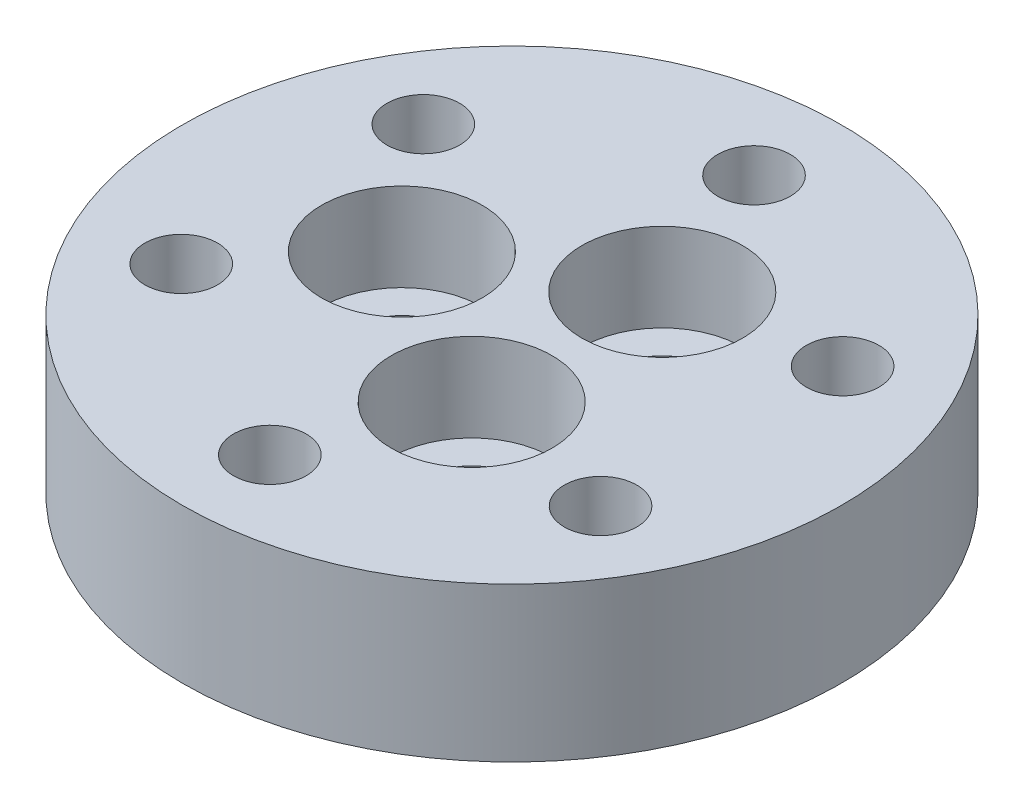
from build123d import *

# Parameters (mm, degrees)
SKETCH_1_R          = 14.975
EXTRUDE_1_DEPTH     = 7
SKETCH_2_R          = 2.1
CUT_EXTRUDE_1_DEPTH = 10
SKETCH_3_R          = 1.65
CUT_EXTRUDE_2_DEPTH = 10
SKETCH_5_R          = 3.65
CUT_EXTRUDE_3_DEPTH = 4


with BuildPart() as part:
    # 草图1 → 凸台-拉伸1 (new body)
    with BuildSketch(Plane(origin=(0, 0, 0), x_dir=(1, 0, 0), z_dir=(0, 1, 0))):
        with Locations(Location((0, 0, 0), (0, 0, 270))):
            Circle(SKETCH_1_R)
    extrude(amount=EXTRUDE_1_DEPTH)

    # 草图2 → 切除-拉伸1 (cut)
    with BuildSketch(Plane(origin=(0, 7, 0), x_dir=(1, 0, 0), z_dir=(0, 1, 0))):
        with Locations(Location((-5, 0, 0), (0, 0, 270))):
            Circle(SKETCH_2_R)
        with Locations(Location((2.5, 4.330127019, 0), (0, 0, 270))):
            Circle(SKETCH_2_R)
        with Locations(Location((2.5, -4.330127019, 0), (0, 0, 270))):
            Circle(SKETCH_2_R)
    extrude(amount=-CUT_EXTRUDE_1_DEPTH, mode=Mode.SUBTRACT)

    # 草图3 → 切除-拉伸2 (cut)
    with BuildSketch(Plane(origin=(0, 7, 0), x_dir=(1, 0, 0), z_dir=(0, 1, 0))):
        with Locations(Location((0, 11, 0), (0, 0, 270))):
            Circle(SKETCH_3_R)
        with Locations(Location((9.526279442, 5.5, 0), (0, 0, 270))):
            Circle(SKETCH_3_R)
        with Locations(Location((9.526279442, -5.5, 0), (0, 0, 270))):
            Circle(SKETCH_3_R)
        with Locations(Location((0, -11, 0), (0, 0, 270))):
            Circle(SKETCH_3_R)
        with Locations(Location((-9.526279442, -5.5, 0), (0, 0, 270))):
            Circle(SKETCH_3_R)
        with Locations(Location((-9.526279442, 5.5, 0), (0, 0, 270))):
            Circle(SKETCH_3_R)
    extrude(amount=-CUT_EXTRUDE_2_DEPTH, mode=Mode.SUBTRACT)

    # 草图5 → 切除-拉伸3 (cut)
    with BuildSketch(Plane(origin=(0, 7, 0), x_dir=(1, 0, 0), z_dir=(0, 1, 0))):
        with Locations(Location((-5, 0, 0), (0, 0, 270))):
            Circle(SKETCH_5_R)
        with Locations(Location((2.5, 4.330127019, 0), (0, 0, 270))):
            Circle(SKETCH_5_R)
        with Locations(Location((2.5, -4.330127019, 0), (0, 0, 270))):
            Circle(SKETCH_5_R)
    extrude(amount=-CUT_EXTRUDE_3_DEPTH, mode=Mode.SUBTRACT)


solid = part.part
